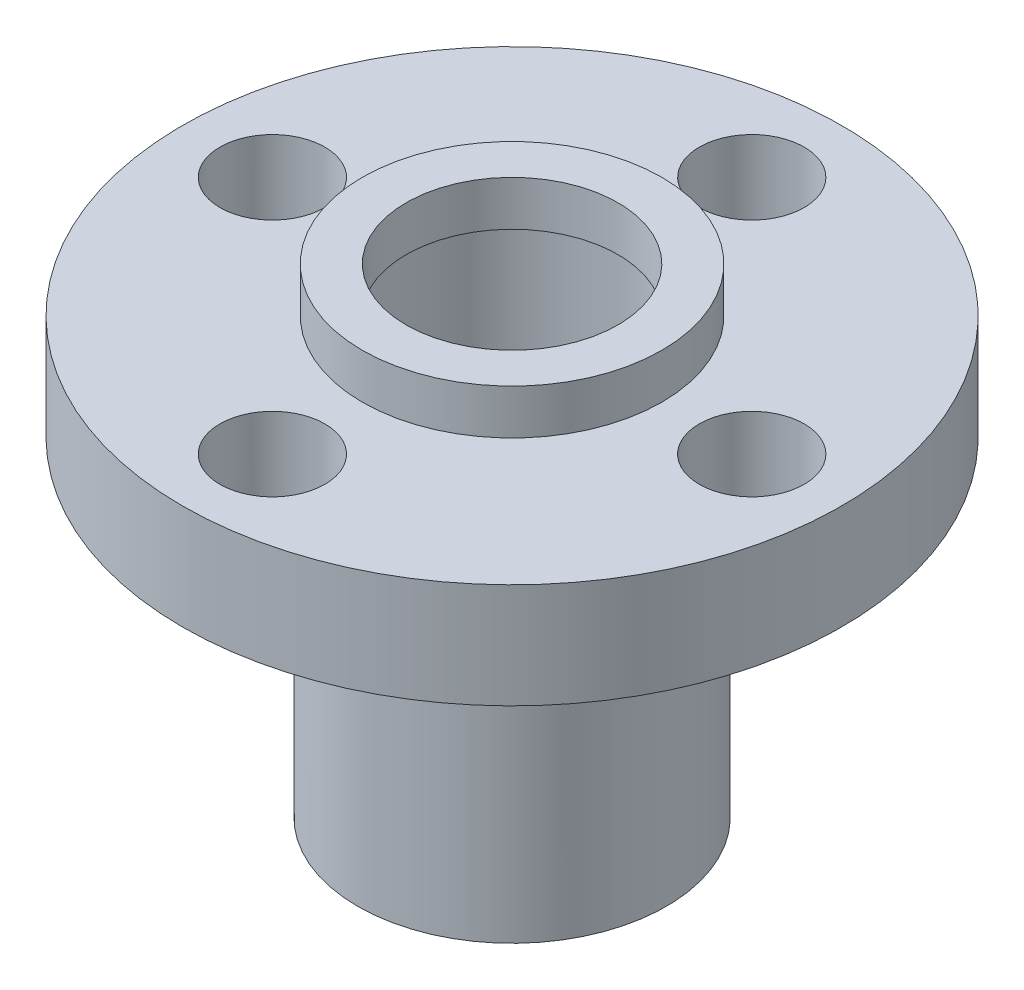
from build123d import *

# Parameters (mm, degrees)
SKETCH_1_R               = 11
EXTRUDE_2_DEPTH          = 3.5
SKETCH_2_R               = 5.15
EXTRUDE_3_DEPTH          = 11
CUT_EXTRUDE_1_DEPTH      = 22.266170318
CUT_EXTRUDE_1_DEPTH_BACK = 22.266170318
SKETCH_3_R               = 4
CUT_EXTRUDE_4_REACH      = 23.266
SKETCH_4_R               = 1.75
PATTERN_CIRCULAR_6_COUNT = 4
SKETCH_7_R               = 5
EXTRUDE_4_DEPTH          = 1.5
SKETCH_8_R               = 3.535076685
CUT_EXTRUDE_5_DEPTH      = 23.315913604


with BuildPart() as part:
    # 草图1 → 凸台-拉伸2 (new body)
    with BuildSketch(Plane(origin=(0, 0, 0), x_dir=(1, 0, 0), z_dir=(0, 1, 0))):
        with Locations(Location((0, 0, 0), (0, 0, 270))):
            Circle(SKETCH_1_R)
    extrude(amount=EXTRUDE_2_DEPTH)

    # 草图2 → 凸台-拉伸3 (add)
    with BuildSketch(Plane.XZ):
        with Locations(Location((0, 0, 0), (0, 0, 90))):
            Circle(SKETCH_2_R)
    extrude(amount=EXTRUDE_3_DEPTH)

    # 草图3 → 切除-拉伸1 (cut, two sides: drawn at the far end of the back side and taken through both)
    with BuildSketch(Plane.XZ.offset(11).offset(-CUT_EXTRUDE_1_DEPTH_BACK)):
        with Locations(Location((0, 0, 0), (0, 0, 270))):
            Circle(SKETCH_3_R)
    extrude(amount=CUT_EXTRUDE_1_DEPTH + CUT_EXTRUDE_1_DEPTH_BACK, mode=Mode.SUBTRACT)

    # 草图4 → 切除-拉伸4 (cut, up to next)
    with BuildSketch(Plane(origin=(0, 3.5, 0), x_dir=(1, 0, 0), z_dir=(0, 1, 0)), mode=Mode.PRIVATE) as cut_extrude_4_sk1:
        with Locations(Location((0, 8, 0), (0, 0, 270))):
            Circle(SKETCH_4_R)
    cut_extrude_4_tool1 = extrude(cut_extrude_4_sk1.sketch, amount=-CUT_EXTRUDE_4_REACH, mode=Mode.PRIVATE) & part.part
    cut_extrude_4 = cut_extrude_4_tool1.solids().sort_by_distance((0, 3.5, -8))[0]
    add(cut_extrude_4, mode=Mode.SUBTRACT)

    # 阵列(圆周)6: 切除-拉伸4 ×4 about axis
    pattern_circular_6_axis = Axis((0, 0, 0), (0, 1, 0))
    for i in range(1, PATTERN_CIRCULAR_6_COUNT):
        add(cut_extrude_4.rotate(pattern_circular_6_axis, i * 360 / PATTERN_CIRCULAR_6_COUNT), mode=Mode.SUBTRACT)

    # 草图7 → 凸台-拉伸4 (add)
    with BuildSketch(Plane(origin=(0, 3.5, 0), x_dir=(1, 0, 0), z_dir=(0, 1, 0))):
        with Locations(Location((0, 0, 0), (0, 0, 270))):
            Circle(SKETCH_7_R)
    extrude(amount=EXTRUDE_4_DEPTH)

    # 草图8 → 切除-拉伸5 (cut, through all)
    with BuildSketch(Plane(origin=(0, 5, 0), x_dir=(1, 0, 0), z_dir=(0, 1, 0))):
        with Locations(Location((0, 0, 0), (0, 0, 270))):
            Circle(SKETCH_8_R)
    extrude(amount=-CUT_EXTRUDE_5_DEPTH, mode=Mode.SUBTRACT)


solid = part.part
